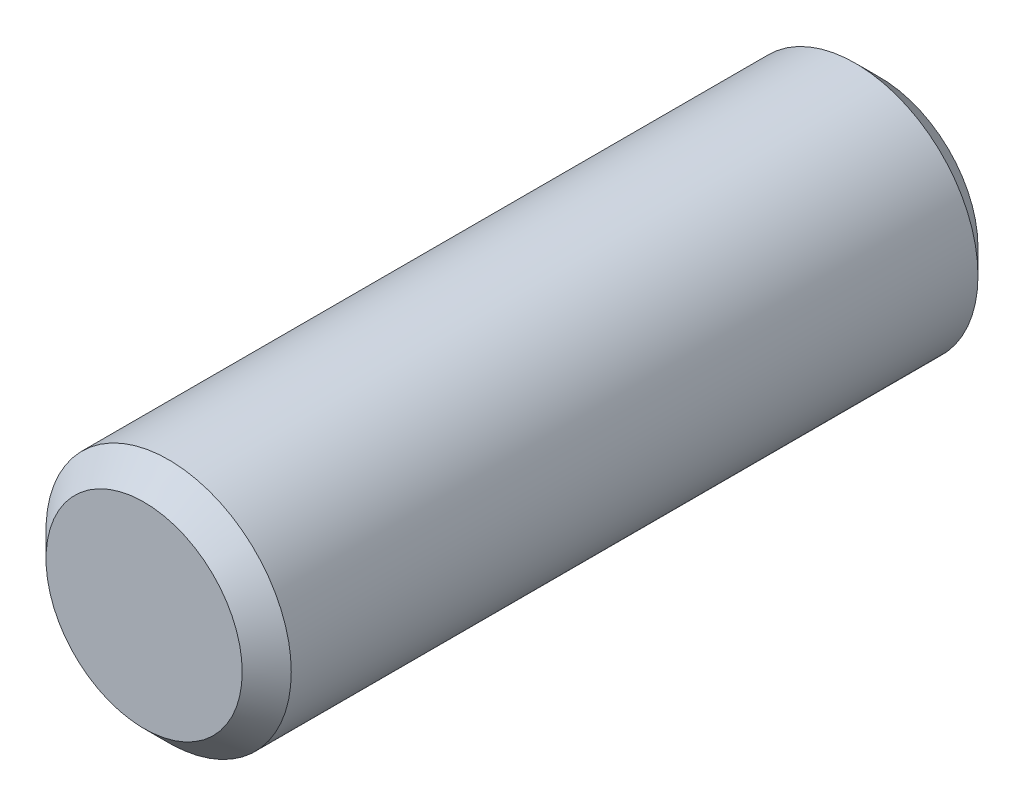
from build123d import *

# Parameters (mm, degrees)
SKETCH_1_R      = 1
EXTRUDE_1_DEPTH = 6
CHAMFER_1_SIZE  = 0.2


with BuildPart() as part:
    # 草图1 → 凸台-拉伸1 (new body)
    with BuildSketch(Plane.XY):
        Circle(SKETCH_1_R)
    extrude(amount=EXTRUDE_1_DEPTH)

    # 倒角1
    chamfer_1_edges = [part.edges().sort_by_distance(p)[0] for p in [
        (-1, 0, 0),
        (-1, 0, 6),
    ]]
    chamfer(chamfer_1_edges, length=CHAMFER_1_SIZE)


solid = part.part
